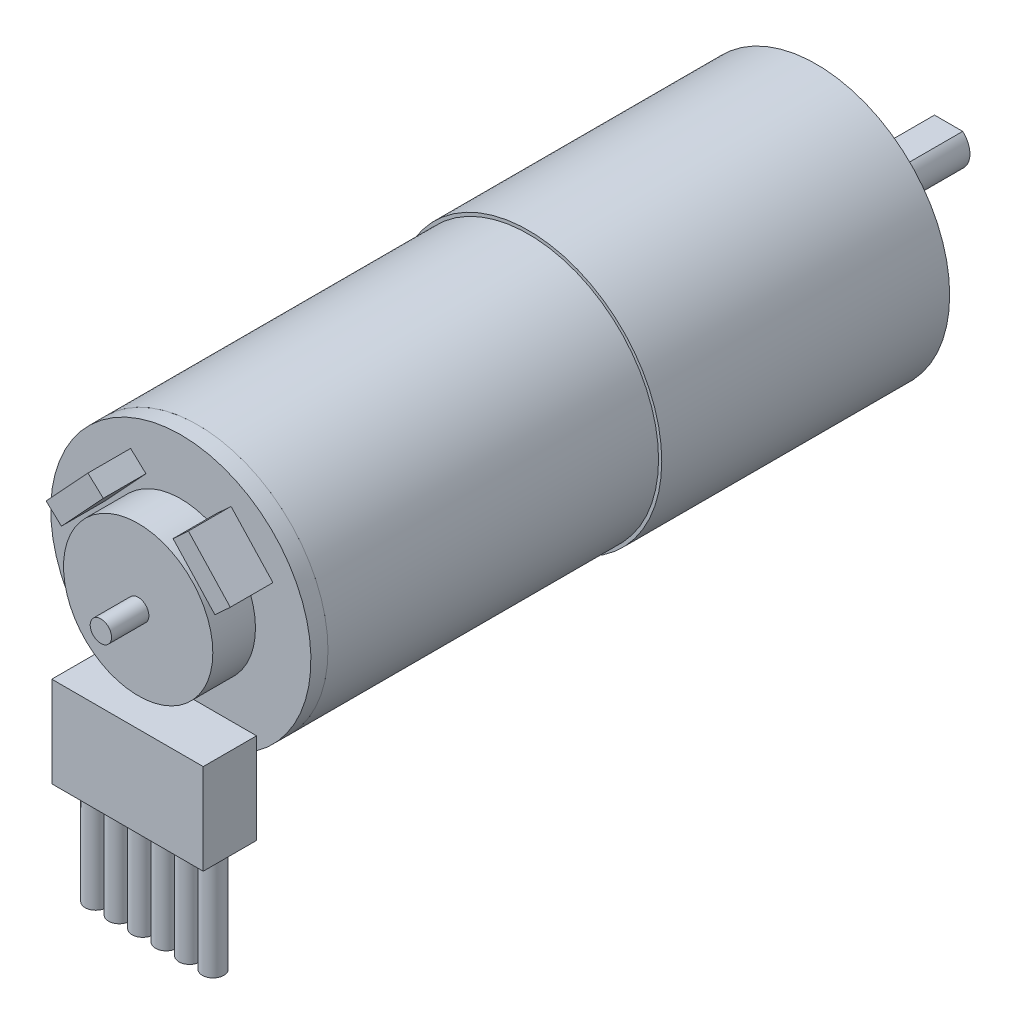
from build123d import *

# Parameters (mm, degrees)
ESQUISSE1_R             = 12.5
BOSS_EXTRU_1_DEPTH      = 27
ESQUISSE5_R             = 3.5
BOSS_EXTRU_5_DEPTH      = 2.7
ESQUISSE6_R             = 2
BOSS_EXTRU_6_DEPTH      = 9.7
ESQUISSE7_W             = 2.645751312
ESQUISSE7_H             = 1.189235155
ENL_V_MAT_EXTRU_1_DEPTH = 8
D_GAGEMENT_M31_D        = 3.4
D_GAGEMENT_M31_DEPTH    = 6
D_GAGEMENT_M31_TIP      = 1.021463052
ESQUISSE2_R             = 12.2
BOSS_EXTRU_2_DEPTH      = 31
ESQUISSE3_R             = 12.2
BOSS_EXTRU_3_DEPTH      = 1.6
ESQUISSE4_R             = 7
BOSS_EXTRU_4_DEPTH      = 4
ESQUISSE14_R            = 1
BOSS_EXTRU_10_DEPTH     = 3.5
BOSS_EXTRU_8_DEPTH      = 4
ESQUISSE11_W            = 14.2
ESQUISSE11_H            = 8.5
BOSS_EXTRU_7_DEPTH      = 5
ESQUISSE13_R            = 1
BOSS_EXTRU_9_DEPTH      = 10


with BuildPart() as part:
    # Esquisse1 → Boss.-Extru.1 (new body)
    with BuildSketch(Plane.XY):
        Circle(ESQUISSE1_R)
    extrude(amount=BOSS_EXTRU_1_DEPTH)

    # Esquisse5 → Boss.-Extru.5 (add)
    with BuildSketch(Plane(origin=(0, 0, 0), x_dir=(-1, 0, 0), z_dir=(0, 0, -1))):
        with Locations(Location((0, 0, 0), (0, 0, 180))):
            Circle(ESQUISSE5_R)
    extrude(amount=BOSS_EXTRU_5_DEPTH)

    # Esquisse6 → Boss.-Extru.6 (add)
    with BuildSketch(Plane(origin=(0, 0, -2.7), x_dir=(-1, 0, 0), z_dir=(0, 0, -1))):
        Circle(ESQUISSE6_R)
    extrude(amount=BOSS_EXTRU_6_DEPTH)

    # Esquisse7 → Enlèv. mat.-Extru.1 (cut)
    with BuildSketch(Plane(origin=(0, 0, -12.4), x_dir=(-1, 0, 0), z_dir=(0, 0, -1))):
        with Locations((0, 2.094617578)):
            Rectangle(ESQUISSE7_W, ESQUISSE7_H)
    extrude(amount=-ENL_V_MAT_EXTRU_1_DEPTH, mode=Mode.SUBTRACT)

    # Dégagement M31
    with Locations(Plane(origin=(0, 0, 0), x_dir=(-1, 0, 0), z_dir=(0, 0, -1))):
        with Locations((0, 8.5), (0, -8.5)):
            Hole(D_GAGEMENT_M31_D / 2, depth=D_GAGEMENT_M31_DEPTH)
            with Locations((0, 0, -(D_GAGEMENT_M31_DEPTH + D_GAGEMENT_M31_TIP / 2))):  # 118° drill point
                Cone(0, D_GAGEMENT_M31_D / 2, D_GAGEMENT_M31_TIP, mode=Mode.SUBTRACT)

    # Esquisse2 → Boss.-Extru.2 (add)
    with BuildSketch(Plane.XY.offset(27)):
        Circle(ESQUISSE2_R)
    extrude(amount=BOSS_EXTRU_2_DEPTH)


with BuildPart() as body_2:
    # Esquisse3 → Boss.-Extru.3 (new body)
    with BuildSketch(Plane.XY.offset(58)):
        Circle(ESQUISSE3_R)
    extrude(amount=BOSS_EXTRU_3_DEPTH)

    # Esquisse4 → Boss.-Extru.4 (add)
    with BuildSketch(Plane.XY.offset(59.6)):
        Circle(ESQUISSE4_R)
    extrude(amount=BOSS_EXTRU_4_DEPTH)

    # Esquisse14 → Boss.-Extru.10 (add)
    with BuildSketch(Plane.XY.offset(63.6)):
        Circle(ESQUISSE14_R)
    extrude(amount=BOSS_EXTRU_10_DEPTH)

    # Esquisse12 → Boss.-Extru.8 (add)
    with BuildSketch(Plane.XY.offset(59.6)):
        Polygon((-8.637517892, 4.508988416), (-4.70937524, 8.736232329), (-3.272423838, 7.400953314), (-7.20056649, 3.173709401), align=None)
        Polygon((7.20056649, 3.173709401), (8.637517892, 4.508988416), (4.70937524, 8.736232329), (3.272423838, 7.400953314), align=None)
    extrude(amount=BOSS_EXTRU_8_DEPTH)

    # Esquisse11 → Boss.-Extru.7 (add)
    with BuildSketch(Plane.XY.offset(59.6)):
        with Locations((0, -12.95)):
            Rectangle(ESQUISSE11_W, ESQUISSE11_H)
    extrude(amount=BOSS_EXTRU_7_DEPTH)

    # Esquisse13 → Boss.-Extru.9 (add)
    with BuildSketch(Plane.XZ.offset(17.2)):
        with Locations(Location((-5.474703178, 62.1, 0), (0, 0, 180))):
            Circle(ESQUISSE13_R)
        with Locations(Location((-3.274703178, 62.1, 0), (0, 0, 180))):
            Circle(ESQUISSE13_R)
        with Locations(Location((-1.074703178, 62.1, 0), (0, 0, 180))):
            Circle(ESQUISSE13_R)
        with Locations(Location((1.125296822, 62.1, 0), (0, 0, 180))):
            Circle(ESQUISSE13_R)
        with Locations(Location((3.325296822, 62.1, 0), (0, 0, 180))):
            Circle(ESQUISSE13_R)
        with Locations(Location((5.525296822, 62.1, 0), (0, 0, 180))):
            Circle(ESQUISSE13_R)
    extrude(amount=BOSS_EXTRU_9_DEPTH)


solid = Compound([part.part, body_2.part])
